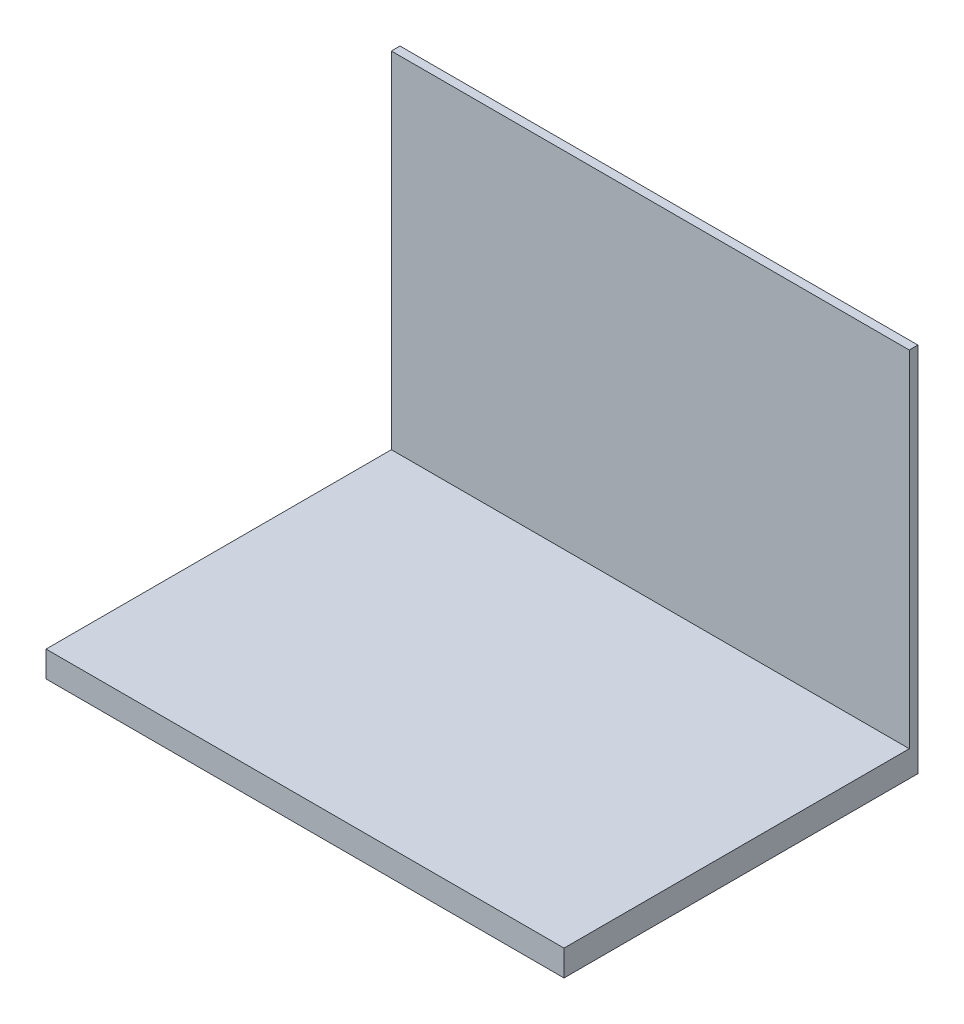
from build123d import *

# Parameters (mm, degrees)
BOSS_EXTRUDE1_DEPTH = 190.5


with BuildPart() as part:
    # Sketch1 → Boss-Extrude1 (new, symmetric)
    with BuildSketch(Plane(origin=(0, 0, 0), x_dir=(0, 0, -1), z_dir=(1, 0, 0))):
        Polygon((0, 0), (0, 254), (6.35, 254), (6.35, -19.05), (-254, -19.05), (-254, 0), align=None)
    extrude(amount=BOSS_EXTRUDE1_DEPTH, both=True)


solid = part.part
